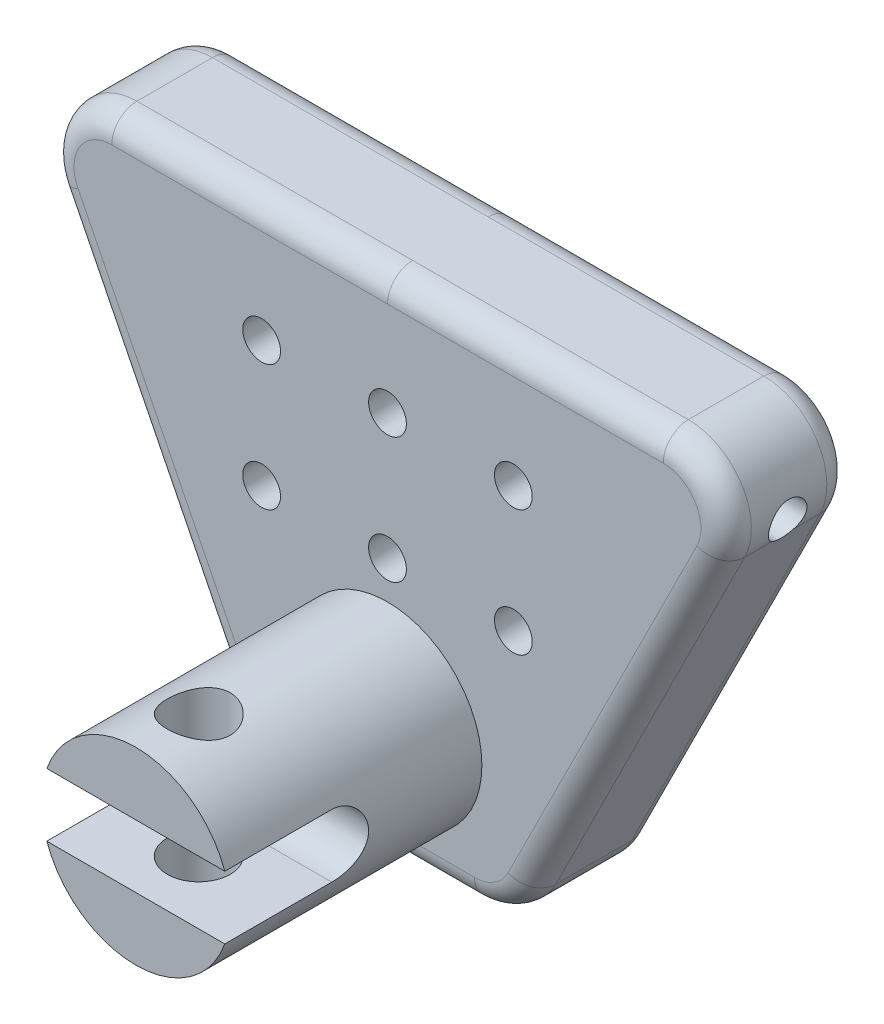
from build123d import *

# Parameters (mm, degrees)
BOSS_EXTRUDE1_DEPTH = 10
FILLET1_R           = 5
FILLET2_R           = 5
FILLET3_R           = 2
FILLET4_R           = 2
FILLET5_R           = 5
FILLET6_R           = 5
FILLET7_R           = 2
FILLET8_R           = 2
SKETCH2_R           = 7.5
BOSS_EXTRUDE2_DEPTH = 20
CUT_EXTRUDE1_DEPTH  = 57.781501862
SKETCH5_R           = 2.5
CUT_EXTRUDE3_DEPTH  = 57.781501914
SKETCH11_R          = 1.5
CUT_EXTRUDE6_DEPTH  = 57.781501914
SKETCH12_R          = 1.5
CUT_EXTRUDE7_DEPTH  = 57.781501914


with BuildPart() as part:
    # Sketch1 → Boss-Extrude1 (new body)
    with BuildSketch(Plane.XY):
        Polygon((0, 0), (10, 0), (30, 40), (0, 40), align=None)
    boss_extrude1 = extrude(amount=BOSS_EXTRUDE1_DEPTH)

    # Fillet1
    fillet1_edges = [part.edges().sort_by_distance(p)[0] for p in [
        (30, 40, 5),
    ]]
    fillet(fillet1_edges, radius=FILLET1_R)

    # Fillet2
    fillet2_edges = [part.edges().sort_by_distance(p)[0] for p in [
        (10, 0, 5),
    ]]
    fillet(fillet2_edges, radius=FILLET2_R)

    # Fillet3
    fillet3_edges = [part.edges().sort_by_distance(p)[0] for p in [
        (10.954915028, 40, 10),
        (26.163084098, 37.628655561, 10),
        (18.881966011, 17.763932023, 10),
        (9.538485617, 0.746745958, 10),
        (3.454915028, 0, 10),
    ]]
    fillet(fillet3_edges, radius=FILLET3_R)

    # Fillet4
    fillet4_edges = [part.edges().sort_by_distance(p)[0] for p in [
        (10.954915028, 40, 0),
        (26.163084098, 37.628655561, 0),
        (18.881966011, 17.763932023, 0),
        (9.538485617, 0.746745958, 0),
        (3.454915028, 0, 0),
    ]]
    fillet(fillet4_edges, radius=FILLET4_R)

    # Mirror1: Boss-Extrude1 across plane
    add(boss_extrude1.mirror(Plane(origin=(0, 0, 0), x_dir=(0, 0, 1), z_dir=(1, 0, 0))))

    # Fillet5
    fillet5_edges = [part.edges().sort_by_distance(p)[0] for p in [
        (-30, 40, 5),
    ]]
    fillet(fillet5_edges, radius=FILLET5_R)

    # Fillet6
    fillet6_edges = [part.edges().sort_by_distance(p)[0] for p in [
        (-10, 0, 5),
    ]]
    fillet(fillet6_edges, radius=FILLET6_R)

    # Fillet7
    fillet7_edges = [part.edges().sort_by_distance(p)[0] for p in [
        (-3.454915028, 0, 0),
        (-9.538485617, 0.746745958, 0),
        (-10.954915028, 40, 0),
        (-26.163084098, 37.628655561, 0),
        (-18.881966011, 17.763932023, 0),
    ]]
    fillet(fillet7_edges, radius=FILLET7_R)

    # Fillet8
    fillet8_edges = [part.edges().sort_by_distance(p)[0] for p in [
        (-3.454915028, 0, 10),
        (-9.538485617, 0.746745958, 10),
        (-10.954915028, 40, 10),
        (-26.163084098, 37.628655561, 10),
        (-18.881966011, 17.763932023, 10),
    ]]
    fillet(fillet8_edges, radius=FILLET8_R)

    # Sketch2 → Boss-Extrude2 (add)
    with BuildSketch(Plane.XY.offset(10)):
        with Locations((0, 10)):
            Circle(SKETCH2_R)
    extrude(amount=BOSS_EXTRUDE2_DEPTH)

    # Sketch4 → Cut-Extrude1 (cut, through all)
    with BuildSketch(Plane(origin=(0, 0, 0), x_dir=(0, 0, -1), z_dir=(1, 0, 0))):
        with BuildLine():
            Line((-21.5, 12.5), (-30, 12.5))
            Line((-30, 12.5), (-30, 7.5))
            Line((-30, 7.5), (-21.5, 7.5))
            ThreePointArc((-21.5, 7.5), (-19, 10), (-21.5, 12.5))
        make_face()
    cut_extrude1 = extrude(amount=-CUT_EXTRUDE1_DEPTH, mode=Mode.SUBTRACT)

    # Mirror2: Cut-Extrude1 across plane
    add(cut_extrude1.mirror(Plane(origin=(0, 0, 0), x_dir=(0, 0, 1), z_dir=(1, 0, 0))), mode=Mode.SUBTRACT)

    # Sketch5 → Cut-Extrude3 (cut, through all)
    with BuildSketch(Plane(origin=(0, 0, 0), x_dir=(1, 0, 0), z_dir=(0, 1, 0))):
        with Locations(Location((0, -25, 0), (0, 0, 90))):
            Circle(SKETCH5_R)
    extrude(amount=CUT_EXTRUDE3_DEPTH, mode=Mode.SUBTRACT)

    # Sketch11 → Cut-Extrude6 (cut, through all)
    with BuildSketch(Plane(origin=(0, 0, 0), x_dir=(-1, 0, 0), z_dir=(0, 0, -1))):
        with Locations((0, 30.50121957)):
            Circle(SKETCH11_R)
        with Locations((-10, 30.50121957)):
            Circle(SKETCH11_R)
        with Locations((10, 30.50121957)):
            Circle(SKETCH11_R)
        with Locations((0, 20.50121957)):
            Circle(SKETCH11_R)
        with Locations((10, 20.50121957)):
            Circle(SKETCH11_R)
        with Locations((-10, 20.50121957)):
            Circle(SKETCH11_R)
    extrude(amount=-CUT_EXTRUDE6_DEPTH, mode=Mode.SUBTRACT)

    # Sketch12 → Cut-Extrude7 (cut, through all)
    with BuildSketch(Plane(origin=(0, 0, 0), x_dir=(0, 0, -1), z_dir=(1, 0, 0))):
        with Locations((-5, 34)):
            Circle(SKETCH12_R)
    cut_extrude7 = extrude(amount=-CUT_EXTRUDE7_DEPTH, mode=Mode.SUBTRACT)

    # Mirror3: Cut-Extrude7 across plane
    add(cut_extrude7.mirror(Plane(origin=(0, 0, 0), x_dir=(0, 0, 1), z_dir=(1, 0, 0))), mode=Mode.SUBTRACT)


solid = part.part
